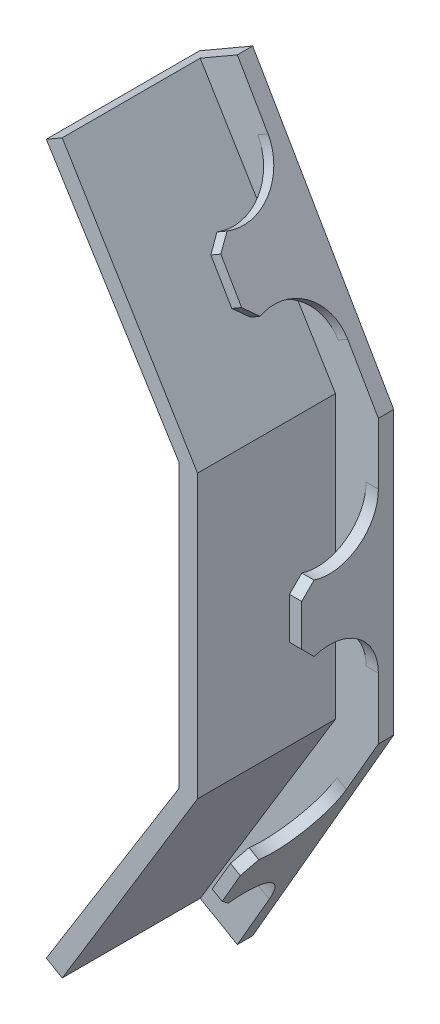
from build123d import *

# Parameters (mm, degrees)
BOSS_EXTRUDE2_DEPTH = 25
CUT_EXTRUDE4_DEPTH  = 22.5
CUT_EXTRUDE5_DEPTH  = 2
CUT_EXTRUDE6_DEPTH  = 2
CUT_EXTRUDE7_DEPTH  = 2
SKETCH9_R           = 2.4
BOSS_EXTRUDE3_DEPTH = 10


with BuildPart() as part:
    # Sketch1 → Boss-Extrude2 (new body)
    with BuildSketch(Plane(origin=(0, 0, 0), x_dir=(0, 1, 0), z_dir=(0, 0, 1))):
        Polygon((0, 0), (46, 0), (85.837168574, 23), (80.837168574, 31.660254038), (46, 10), (0, 10), (-34.837168574, 31.660254038), (-39.837168574, 23), align=None)
    extrude(amount=BOSS_EXTRUDE2_DEPTH)

    # Sketch5 → Cut-Extrude4 (cut)
    with BuildSketch(Plane.XY.offset(25)):
        Polygon((-24.732050808, -38.837168574), (-29.062177826, -36.337168574), (-7, 0), (-7, 46), (-29.062177826, 82.337168574), (-24.732050808, 84.837168574), (-2, 46), (-2, 0), align=None)
    extrude(amount=-CUT_EXTRUDE4_DEPTH, mode=Mode.SUBTRACT)

    # Sketch6 → Cut-Extrude5 (cut)
    with BuildSketch(Plane.YZ):
        with BuildLine():
            Line((0, 2.5), (10, 2.5))
            ThreePointArc((10, 2.5), (16.477245972, 5.804759365), (17.603057122, 12.988678845))
            Line((17.603057122, 12.988678845), (19.614378278, 15))
            Line((19.614378278, 15), (26.385621722, 15))
            Line((26.385621722, 15), (28.396942878, 12.988678845))
            ThreePointArc((28.396942878, 12.988678845), (29.522754028, 5.804759365), (36, 2.5))
            Line((36, 2.5), (46, 2.5))
            Line((46, 2.5), (46, 25))
            Line((46, 25), (0, 25))
            Line((0, 25), (0, 2.5))
        make_face()
    extrude(amount=-CUT_EXTRUDE5_DEPTH, mode=Mode.SUBTRACT)

    # Sketch7 → Cut-Extrude6 (cut)
    with BuildSketch(Plane(origin=(19.918584287, 11.5, 0), x_dir=(-0.5000000000000007, 0.8660254037844383, 0), z_dir=(0.8660254037844383, 0.5000000000000007, 0))):
        with BuildLine():
            Line((39.837168574, 25), (39.837168574, 2.5))
            Line((39.837168574, 2.5), (49.837168574, 2.5))
            ThreePointArc((49.837168574, 2.5), (56.314414546, 5.804759365), (57.440225697, 12.988678845))
            Line((57.440225697, 12.988678845), (59.451546852, 15))
            Line((59.451546852, 15), (62.837168574, 15))
            Line((62.837168574, 15), (66.222790296, 15))
            Line((66.222790296, 15), (68.234111452, 12.988678845))
            ThreePointArc((68.234111452, 12.988678845), (69.359922602, 5.804759365), (75.837168574, 2.5))
            Line((75.837168574, 2.5), (85.837168574, 2.5))
            Line((85.837168574, 2.5), (85.837168574, 25))
            Line((85.837168574, 25), (39.837168574, 25))
        make_face()
    extrude(amount=-CUT_EXTRUDE6_DEPTH, mode=Mode.SUBTRACT)

    # Sketch8 → Cut-Extrude7 (cut)
    with BuildSketch(Plane(origin=(0, 0, 0), x_dir=(0.5000000000000014, 0.8660254037844378, 0), z_dir=(0.8660254037844378, -0.5000000000000014, 0))):
        with BuildLine():
            Line((-10.424182503, 2.5), (0, 2.5))
            Line((0, 2.5), (0, 25))
            Line((0, 25), (-46, 25))
            Line((-46, 25), (-46, 2.5))
            Line((-46, 2.5), (-35.575817497, 2.5))
            ThreePointArc((-35.575817497, 2.5), (-29.098571525, 5.804759365), (-27.972760375, 12.988678845))
            Line((-27.972760375, 12.988678845), (-25.961439219, 15))
            Line((-25.961439219, 15), (-23, 15))
            Line((-23, 15), (-20.038560781, 15))
            Line((-20.038560781, 15), (-18.027239625, 12.988678845))
            ThreePointArc((-18.027239625, 12.988678845), (-16.901428475, 5.804759365), (-10.424182503, 2.5))
        make_face()
    extrude(amount=-CUT_EXTRUDE7_DEPTH, mode=Mode.SUBTRACT)

    # Sketch9 → Boss-Extrude3 (add)
    with BuildSketch(Plane(origin=(-10, 0, 0), x_dir=(0, -1, 0), z_dir=(-1, 0, 0))):
        with Locations(Location((-23, 12.5, 0), (0, 0, 90))):
            Circle(SKETCH9_R)
        with Locations(Location((-31, 12.5, 0), (0, 0, 90))):
            Circle(SKETCH9_R)
        with Locations(Location((-15, 12.5, 0), (0, 0, 270))):
            Circle(SKETCH9_R)
    extrude(amount=BOSS_EXTRUDE3_DEPTH)


solid = part.part
